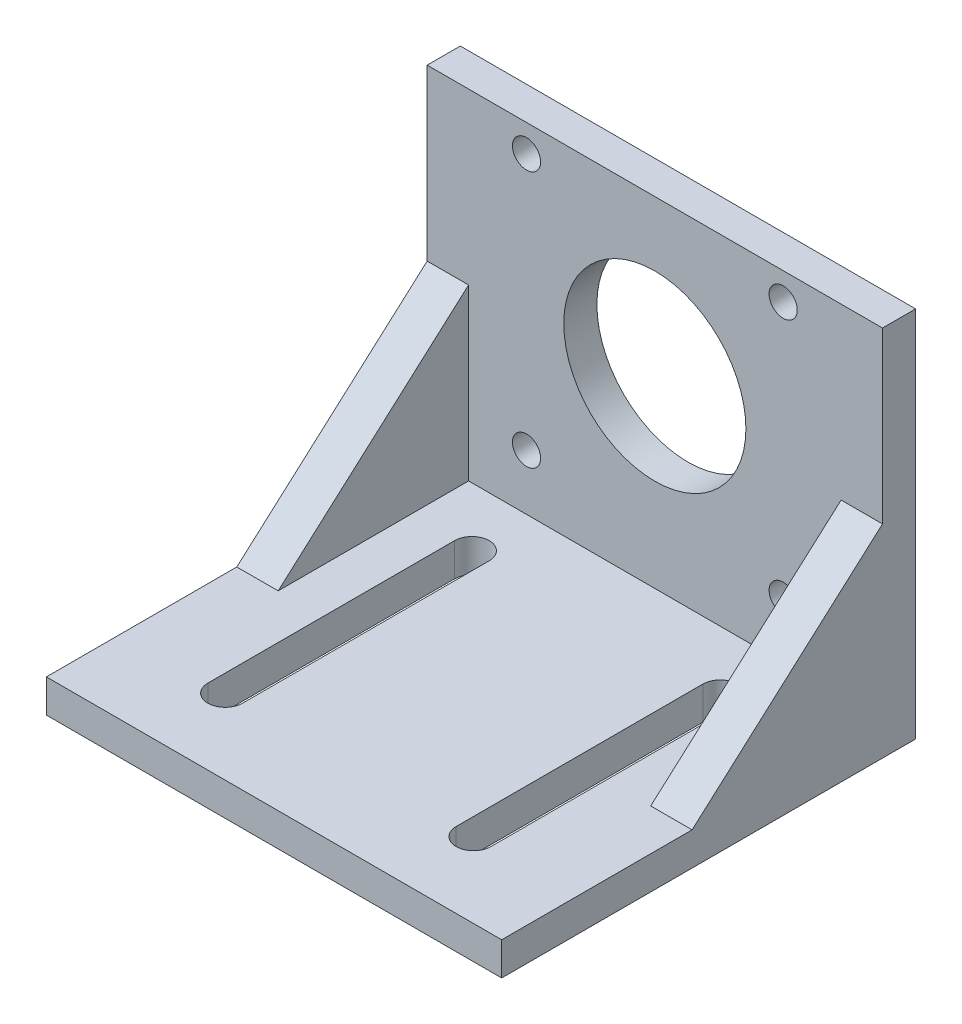
from build123d import *

# Parameters (mm, degrees)
BOSS_EXTRUDE1_DEPTH = 27.5
CUT_EXTRUDE1_REACH  = 72.266
CUT_EXTRUDE2_REACH  = 71.98
BOSS_EXTRUDE2_DEPTH = 5
BOSS_EXTRUDE3_START = -55
BOSS_EXTRUDE3_DEPTH = 5


with BuildPart() as part:
    # Sketch1 → Boss-Extrude1 (new, symmetric)
    with BuildSketch(Plane(origin=(0, 0, 0), x_dir=(0, 0, -1), z_dir=(1, 0, 0))):
        Polygon((0, 0), (50, 0), (50, 45), (46, 45), (46, 4), (0, 4), align=None)
    extrude(amount=BOSS_EXTRUDE1_DEPTH, both=True)

    # Sketch2 → Cut-Extrude1 (cut, up to next)
    with BuildSketch(Plane(origin=(0, 4, 0), x_dir=(1, 0, 0), z_dir=(0, 1, 0)), mode=Mode.PRIVATE) as cut_extrude1_sk1:
        with BuildLine():
            Line((-12.9, 9.1), (-12.9, 38.9))
            ThreePointArc((-12.9, 38.9), (-15, 41), (-17.1, 38.9))
            Line((-17.1, 38.9), (-17.1, 9.1))
            ThreePointArc((-17.1, 9.1), (-16.48492424, 7.61507576), (-15, 7))
            ThreePointArc((-15, 7), (-13.51507576, 7.61507576), (-12.9, 9.1))
        make_face()
    cut_extrude1_tool1 = extrude(cut_extrude1_sk1.sketch, amount=-CUT_EXTRUDE1_REACH, mode=Mode.PRIVATE) & part.part
    # Sketch2 → Cut-Extrude1 (cut, up to next)
    with BuildSketch(Plane(origin=(0, 4, 0), x_dir=(1, 0, 0), z_dir=(0, 1, 0)), mode=Mode.PRIVATE) as cut_extrude1_sk2:
        with BuildLine():
            Line((12.9, 38.9), (12.9, 9.1))
            ThreePointArc((12.9, 9.1), (13.51507576, 7.61507576), (15, 7))
            ThreePointArc((15, 7), (16.48492424, 7.61507576), (17.1, 9.1))
            Line((17.1, 9.1), (17.1, 38.9))
            ThreePointArc((17.1, 38.9), (15, 41), (12.9, 38.9))
        make_face()
    cut_extrude1_tool2 = extrude(cut_extrude1_sk2.sketch, amount=-CUT_EXTRUDE1_REACH, mode=Mode.PRIVATE) & part.part
    add(cut_extrude1_tool1.solids().sort_by_distance((-15, 4, -24))[0], mode=Mode.SUBTRACT)
    add(cut_extrude1_tool2.solids().sort_by_distance((15, 4, -24))[0], mode=Mode.SUBTRACT)

    # Sketch3 → Cut-Extrude2 (cut, up to next)
    with BuildSketch(Plane.XY.offset(-46), mode=Mode.PRIVATE) as cut_extrude2_sk1:
        with BuildLine():
            ThreePointArc((11, 26.216818276), (0, 37.216818276), (-11, 26.216818276))
            ThreePointArc((-11, 26.216818276), (0, 15.216818276), (11, 26.216818276))
        make_face()
    cut_extrude2_tool1 = extrude(cut_extrude2_sk1.sketch, amount=-CUT_EXTRUDE2_REACH, mode=Mode.PRIVATE) & part.part
    # Sketch3 → Cut-Extrude2 (cut, up to next)
    with BuildSketch(Plane.XY.offset(-46), mode=Mode.PRIVATE) as cut_extrude2_sk2:
        with BuildLine():
            ThreePointArc((-17.2, 10.716818276), (-15.5, 9.016818276), (-13.8, 10.716818276))
            ThreePointArc((-13.8, 10.716818276), (-15.5, 12.416818276), (-17.2, 10.716818276))
        make_face()
    cut_extrude2_tool2 = extrude(cut_extrude2_sk2.sketch, amount=-CUT_EXTRUDE2_REACH, mode=Mode.PRIVATE) & part.part
    # Sketch3 → Cut-Extrude2 (cut, up to next)
    with BuildSketch(Plane.XY.offset(-46), mode=Mode.PRIVATE) as cut_extrude2_sk3:
        with BuildLine():
            ThreePointArc((-17.2, 41.716818276), (-15.5, 40.016818276), (-13.8, 41.716818276))
            ThreePointArc((-13.8, 41.716818276), (-15.5, 43.416818276), (-17.2, 41.716818276))
        make_face()
    cut_extrude2_tool3 = extrude(cut_extrude2_sk3.sketch, amount=-CUT_EXTRUDE2_REACH, mode=Mode.PRIVATE) & part.part
    # Sketch3 → Cut-Extrude2 (cut, up to next)
    with BuildSketch(Plane.XY.offset(-46), mode=Mode.PRIVATE) as cut_extrude2_sk4:
        with BuildLine():
            ThreePointArc((13.8, 41.716818276), (15.5, 40.016818276), (17.2, 41.716818276))
            ThreePointArc((17.2, 41.716818276), (15.5, 43.416818276), (13.8, 41.716818276))
        make_face()
    cut_extrude2_tool4 = extrude(cut_extrude2_sk4.sketch, amount=-CUT_EXTRUDE2_REACH, mode=Mode.PRIVATE) & part.part
    # Sketch3 → Cut-Extrude2 (cut, up to next)
    with BuildSketch(Plane.XY.offset(-46), mode=Mode.PRIVATE) as cut_extrude2_sk5:
        with BuildLine():
            ThreePointArc((17.2, 10.716818276), (15.5, 12.416818276), (13.8, 10.716818276))
            ThreePointArc((13.8, 10.716818276), (15.5, 9.016818276), (17.2, 10.716818276))
        make_face()
    cut_extrude2_tool5 = extrude(cut_extrude2_sk5.sketch, amount=-CUT_EXTRUDE2_REACH, mode=Mode.PRIVATE) & part.part
    add(cut_extrude2_tool1.solids().sort_by_distance((0, 26.216818, -46))[0], mode=Mode.SUBTRACT)
    add(cut_extrude2_tool2.solids().sort_by_distance((-15.5, 10.716818, -46))[0], mode=Mode.SUBTRACT)
    add(cut_extrude2_tool3.solids().sort_by_distance((-15.5, 41.716818, -46))[0], mode=Mode.SUBTRACT)
    add(cut_extrude2_tool4.solids().sort_by_distance((15.5, 41.716818, -46))[0], mode=Mode.SUBTRACT)
    add(cut_extrude2_tool5.solids().sort_by_distance((15.5, 10.716818, -46))[0], mode=Mode.SUBTRACT)

    # Sketch5 → Boss-Extrude2 (add)
    with BuildSketch(Plane(origin=(27.5, 0, 0), x_dir=(0, 0, -1), z_dir=(1, 0, 0))):
        Polygon((46, 24.5), (23, 4), (46, 4), align=None)
    extrude(amount=-BOSS_EXTRUDE2_DEPTH)

    # Sketch5<2> → Boss-Extrude3 (add)
    with BuildSketch(Plane(origin=(27.5, 0, 0), x_dir=(0, 0, -1), z_dir=(1, 0, 0)).offset(BOSS_EXTRUDE3_START)):
        Polygon((46, 24.5), (23, 4), (46, 4), align=None)
    extrude(amount=BOSS_EXTRUDE3_DEPTH)


solid = part.part
